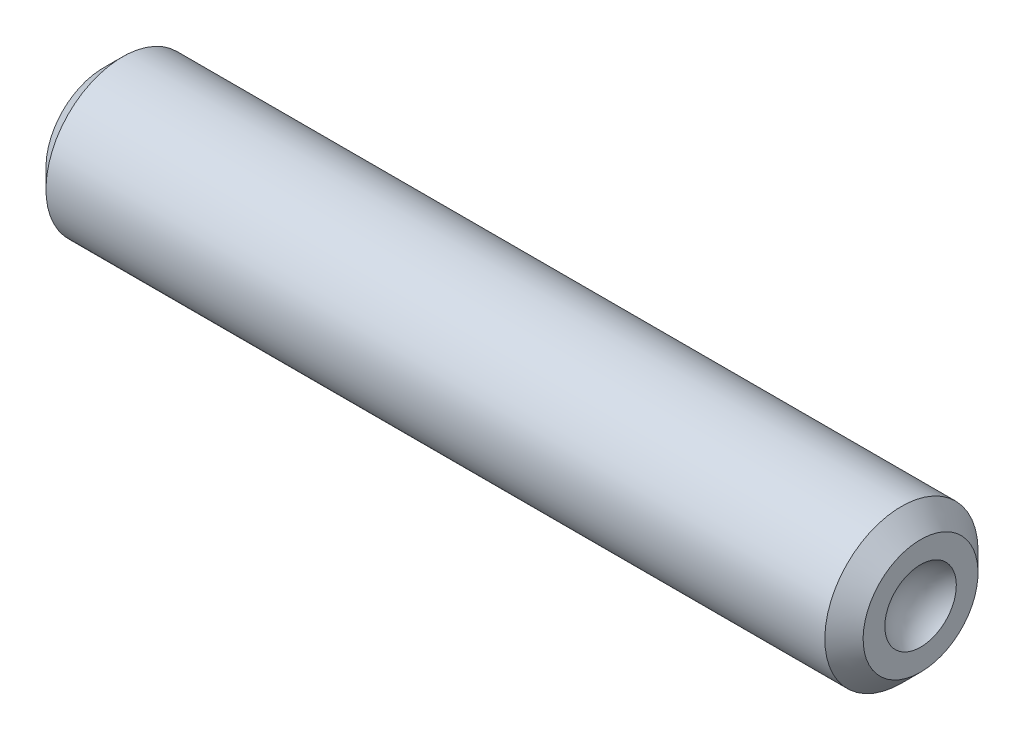
from build123d import *

# Parameters (mm, degrees)
CUT_EXTRUDE1_DEPTH = 14


with BuildPart() as part:
    # Sketch1 → Revolve1 (revolve)
    with BuildSketch(Plane.XY, mode=Mode.PRIVATE) as revolve1_sk:
        with BuildLine():
            Line((0, 0), (0, 1.125))
            Line((0, 1.125), (0.375, 1.5))
            Line((0.375, 1.5), (15.625, 1.5))
            Line((15.625, 1.5), (16, 1.125))
            Line((16, 1.125), (16, 0.7))
            ThreePointArc((16, 0.7), (15.724655592, 0.397059504), (15.625, 0))
            Line((15.625, 0), (0, 0))
        make_face()
    revolve(revolve1_sk.sketch.rotate(Axis((0, 0, 0), (1, 0, 0)), 180), axis=Axis((0, 0, 0), (1, 0, 0)))

    # Sketch2 → Cut-Extrude1 (cut)
    with BuildSketch(Plane.ZY):
        Polygon((0, 0.866025404), (-0.75, 0.433012702), (-0.75, -0.433012702), (0, -0.866025404), (0.75, -0.433012702), (0.75, 0.433012702), align=None)
    extrude(amount=-CUT_EXTRUDE1_DEPTH, mode=Mode.SUBTRACT)


solid = part.part
